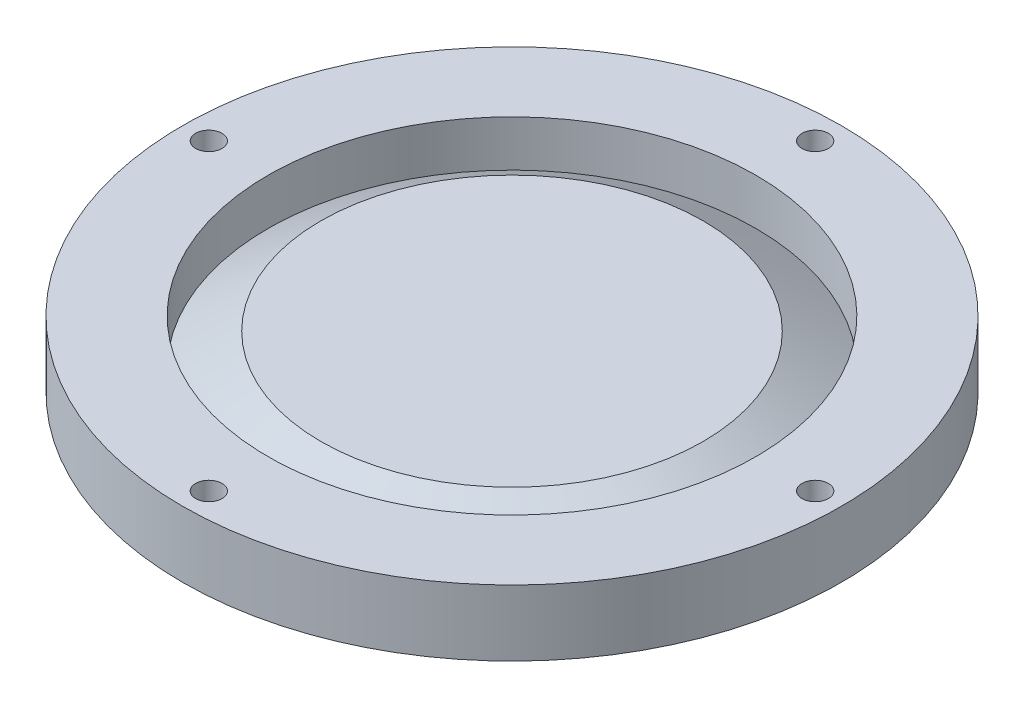
from build123d import *

# Parameters (mm, degrees)
SKETCH_1_R          = 25
EXTRUDE_1_DEPTH     = 5
SKETCH_4_W          = 14.5
SKETCH_4_H          = 1
SKETCH_5_R          = 1
CUT_EXTRUDE_3_DEPTH = 36.707142143


with BuildPart() as part:
    # 草图1 → 凸台-拉伸1 (new body)
    with BuildSketch(Plane(origin=(0, 0, 0), x_dir=(1, 0, 0), z_dir=(0, 1, 0))):
        with Locations(Location((0, 0, 0), (0, 0, 270))):
            Circle(SKETCH_1_R)
    extrude(amount=EXTRUDE_1_DEPTH)

    # 草图4 → 切除-旋转1 (revolve, cut)
    with BuildSketch(Plane.XY, mode=Mode.PRIVATE) as cut_revolve_1_sk:
        with Locations((7.25, 4.5)):
            Rectangle(SKETCH_4_W, SKETCH_4_H)
        Polygon((18.5, 1.5), (18.5, 5), (14.5, 5), (14.5, 4), align=None)
    revolve(cut_revolve_1_sk.sketch.rotate(Axis((0, 0, 0), (0, 1, 0)), 90), axis=Axis((0, 0, 0), (0, 1, 0)), mode=Mode.SUBTRACT)

    # 草图5 → 切除-拉伸3 (cut, through all)
    with BuildSketch(Plane(origin=(0, 5, 0), x_dir=(1, 0, 0), z_dir=(0, 1, 0))):
        with Locations(Location((0, 23, 0), (0, 0, 270))):
            Circle(SKETCH_5_R)
        with Locations(Location((23, 0, 0), (0, 0, 270))):
            Circle(SKETCH_5_R)
        with Locations(Location((0, -23, 0), (0, 0, 270))):
            Circle(SKETCH_5_R)
        with Locations(Location((-23, 0, 0), (0, 0, 270))):
            Circle(SKETCH_5_R)
    extrude(amount=-CUT_EXTRUDE_3_DEPTH, mode=Mode.SUBTRACT)


solid = part.part
